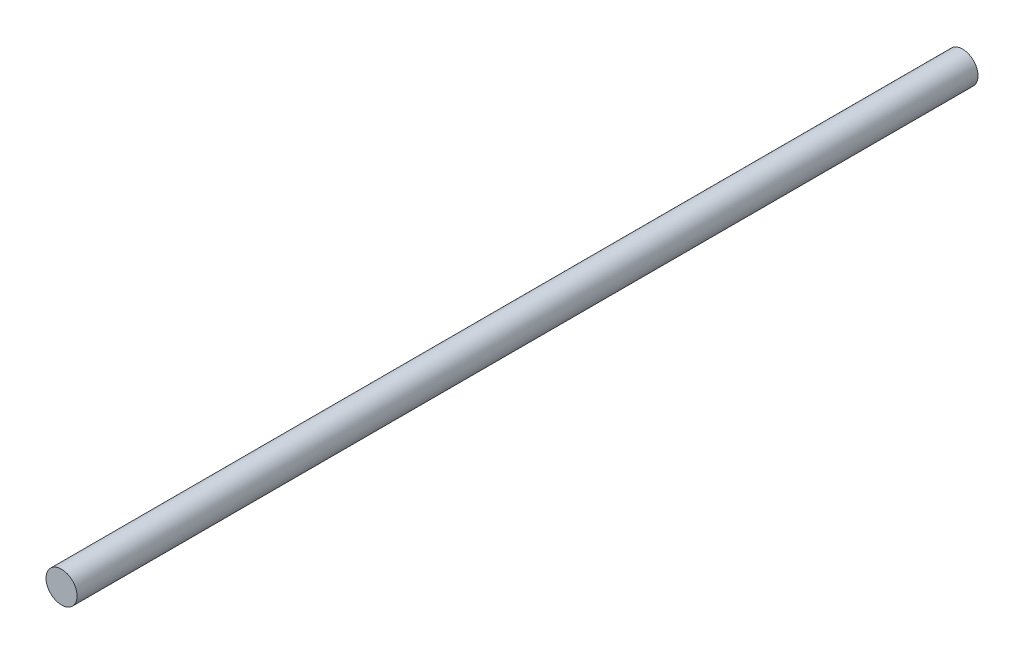
from build123d import *

# Parameters (mm, degrees)
SKETCH1_R           = 1
BOSS_EXTRUDE1_DEPTH = 58


with BuildPart() as part:
    # Sketch1 → Boss-Extrude1 (new body)
    with BuildSketch(Plane.XY):
        with Locations(Location((0, 0, 0), (0, 0, 180))):
            Circle(SKETCH1_R)
    extrude(amount=BOSS_EXTRUDE1_DEPTH)


solid = part.part
